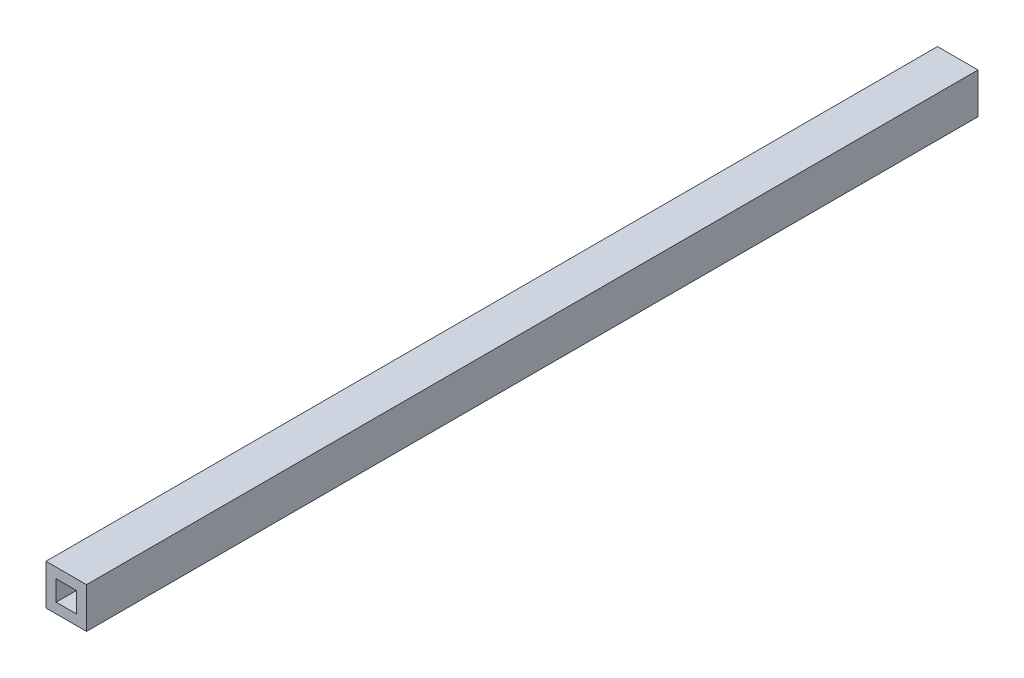
from build123d import *

# Parameters (mm, degrees)
SKETCH1_W           = 20
SKETCH1_H           = 20
SKETCH1_W_2         = 10
SKETCH1_H_2         = 10
EXTRUDE_THIN1_DEPTH = 440


with BuildPart() as part:
    # Sketch1 → Extrude-Thin1 (new body)
    with BuildSketch(Plane.XY):
        Rectangle(SKETCH1_W, SKETCH1_H)
        Rectangle(SKETCH1_W_2, SKETCH1_H_2, mode=Mode.SUBTRACT)
    extrude(amount=EXTRUDE_THIN1_DEPTH)


solid = part.part
